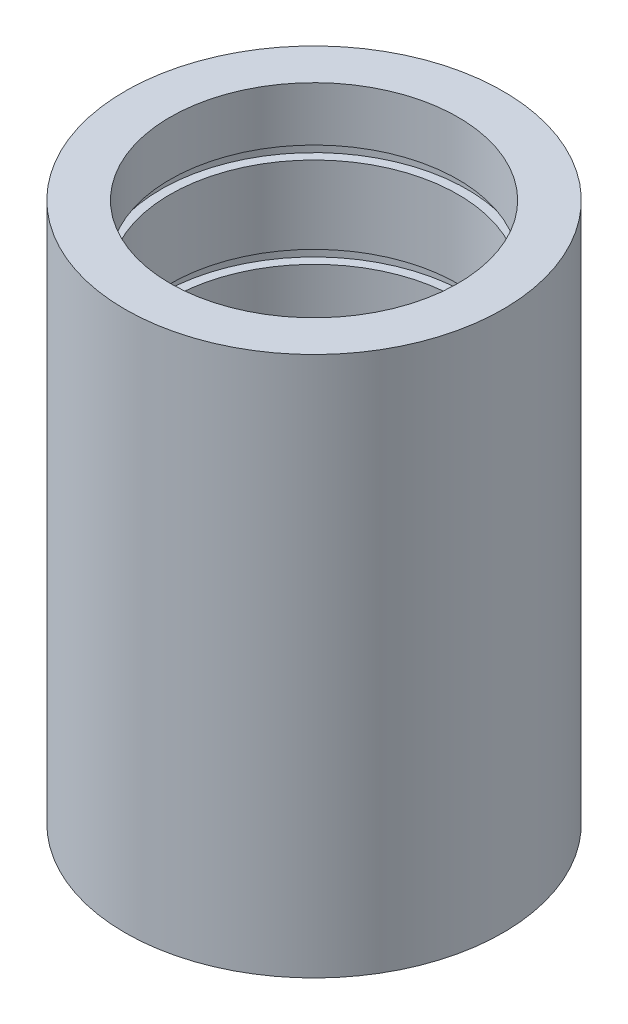
from build123d import *

# Parameters (mm, degrees)
SKETCH1_R                       = 52.5
SKETCH1_R_2                     = 40
BOSS_EXTRUDE1_DEPTH             = 150
SKETCH7_R                       = 42.5
YLIN_URA_DEPTH                  = 3.6
SKETCH8_R                       = 42.5
TOKA_YLIN_URA_DEPTH             = 3.6
CUT_EXTRUDE5_START              = -3.6
SKETCH10_R                      = 42.5
CUT_EXTRUDE5_DEPTH              = 3.6
F_8_0MM_DOWEL_HOLE1_D           = 8
F_8_0MM_DOWEL_HOLE1_DEPTH       = 22.596557524
F_8_0MM_DOWEL_HOLE1_CSINK_D     = 8.05
F_8_0MM_DOWEL_HOLE1_CSINK_ANGLE = 90
F_8_0MM_DOWEL_HOLE1_TIP         = 2.403442476


with BuildPart() as part:
    # Sketch1 → Boss-Extrude1 (new body)
    with BuildSketch(Plane(origin=(0, 0, 0), x_dir=(1, 0, 0), z_dir=(0, 1, 0))):
        with Locations(Location((0, 0, 0), (0, 0, 270))):
            Circle(SKETCH1_R)
        with Locations(Location((0, 0, 0), (0, 0, 270))):
            Circle(SKETCH1_R_2, mode=Mode.SUBTRACT)
    extrude(amount=BOSS_EXTRUDE1_DEPTH)

    # Sketch7 → Ylin ura (cut)
    with BuildSketch(Plane(origin=(0, 135, 0), x_dir=(1, 0, 0), z_dir=(0, 1, 0))):
        with Locations(Location((0, 0, 0), (0, 0, 270))):
            Circle(SKETCH7_R)
    extrude(amount=-YLIN_URA_DEPTH, mode=Mode.SUBTRACT)

    # Sketch8 → Toka ylin ura (cut)
    with BuildSketch(Plane(origin=(0, 109.9, 0), x_dir=(1, 0, 0), z_dir=(0, 1, 0))):
        with Locations(Location((0, 0, 0), (0, 0, 270))):
            Circle(SKETCH8_R)
    extrude(amount=-TOKA_YLIN_URA_DEPTH, mode=Mode.SUBTRACT)

    # Sketch10 → Cut-Extrude5 (cut)
    with BuildSketch(Plane(origin=(0, 50.1, 0), x_dir=(-1, 0, 0), z_dir=(0, -1, 0)).offset(CUT_EXTRUDE5_START)):
        with Locations(Location((0, 0, 0), (0, 0, 270))):
            Circle(SKETCH10_R)
    extrude(amount=CUT_EXTRUDE5_DEPTH, mode=Mode.SUBTRACT)

    # Ø8.0mm Dowel Hole1
    with Locations(Plane(origin=(0, 0, 0), x_dir=(-1, 0, 0), z_dir=(0, -1, 0))):
        with Locations((0, -46.25), (-40.053674925, -23.125), (-40.053674925, 23.125), (0, 46.25), (40.053674925, 23.125), (40.053674925, -23.125)):
            CounterSinkHole(F_8_0MM_DOWEL_HOLE1_D / 2, F_8_0MM_DOWEL_HOLE1_CSINK_D / 2, depth=F_8_0MM_DOWEL_HOLE1_DEPTH, counter_sink_angle=F_8_0MM_DOWEL_HOLE1_CSINK_ANGLE)
            with Locations((0, 0, -(F_8_0MM_DOWEL_HOLE1_DEPTH + F_8_0MM_DOWEL_HOLE1_TIP / 2))):  # 118° drill point
                Cone(0, F_8_0MM_DOWEL_HOLE1_D / 2, F_8_0MM_DOWEL_HOLE1_TIP, mode=Mode.SUBTRACT)


solid = part.part
